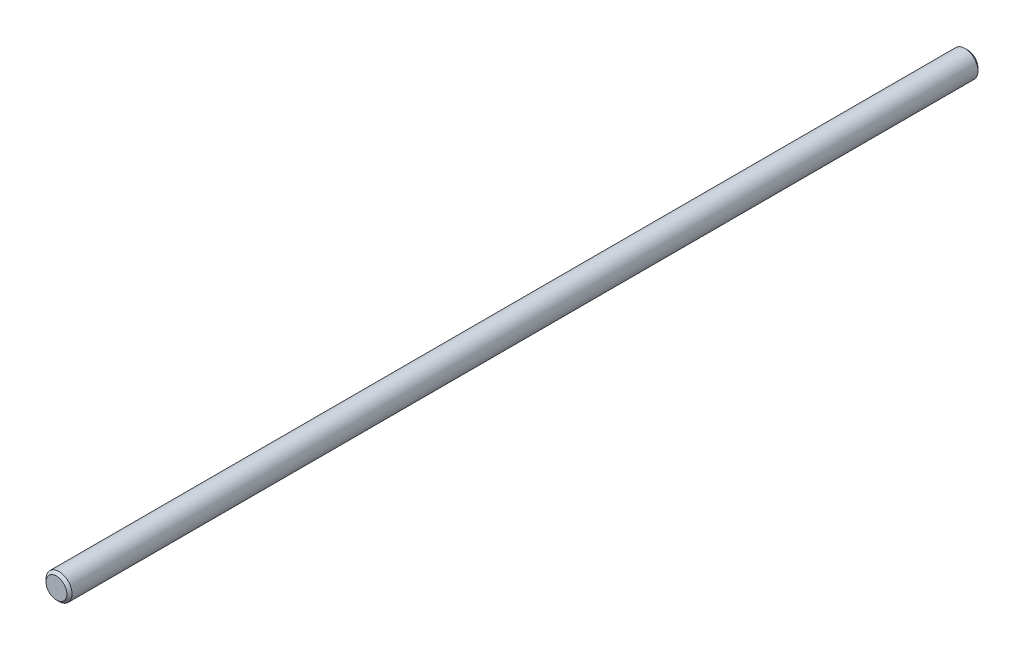
from build123d import *

# Parameters (mm, degrees)
SCHIZZO1_R                   = 5
ESTRUSIONE_ESTRUSIONE1_DEPTH = 350
SMUSSO1_SIZE                 = 1


with BuildPart() as part:
    # Schizzo1 → Estrusione-Estrusione1 (new body)
    with BuildSketch(Plane.XY):
        Circle(SCHIZZO1_R)
    extrude(amount=ESTRUSIONE_ESTRUSIONE1_DEPTH)

    # Smusso1
    smusso1_edges = [part.edges().sort_by_distance(p)[0] for p in [
        (-5, 0, 0),
        (-5, 0, 350),
    ]]
    chamfer(smusso1_edges, length=SMUSSO1_SIZE)


solid = part.part
